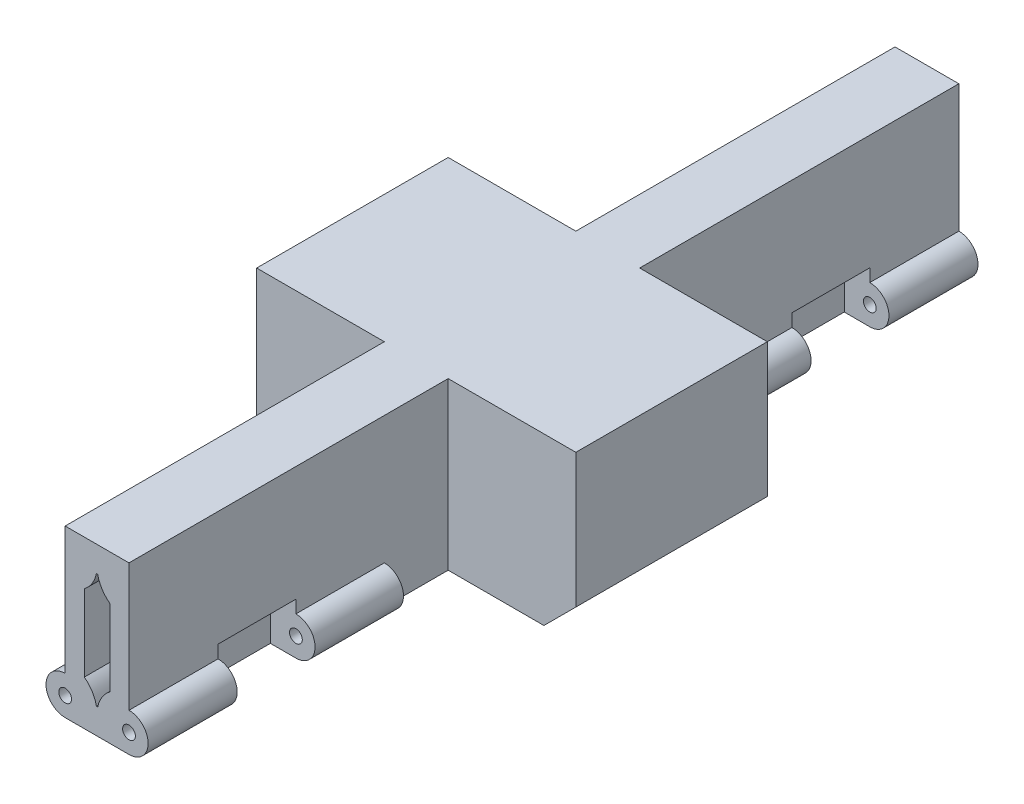
from build123d import *

# Parameters (mm, degrees)
SKETCH_1_W               = 50
SKETCH_1_H               = 26
EXTRUDE_1_DEPTH          = 65
SKETCH_7_W               = 20
SKETCH_7_H               = 26
CUT_EXTRUDE_5_DEPTH      = 50
SKETCH_4_R               = 3
EXTRUDE_3_DEPTH          = 40
SKETCH_5_W               = 12.2
SKETCH_5_H               = 8
CUT_EXTRUDE_3_DEPTH      = 4
SKETCH_6_R               = 1
CUT_EXTRUDE_4_DEPTH      = 40
MIRROR_2_COPY_1_SKETCH_W = 20
MIRROR_2_COPY_1_SKETCH_H = 26
MIRROR_2_COPY_1_DEPTH    = 50
MIRROR_2_COPY_2_SKETCH_R = 3
MIRROR_2_COPY_2_DEPTH    = 40
MIRROR_2_COPY_3_SKETCH_W = 12.2
MIRROR_2_COPY_3_SKETCH_H = 8
MIRROR_2_COPY_3_DEPTH    = 4
MIRROR_2_COPY_4_SKETCH_R = 1
MIRROR_2_COPY_4_DEPTH    = 40
CUT_EXTRUDE_7_DEPTH      = 71.89816586
CUT_EXTRUDE_7_DEPTH_BACK = 71.89816586
CUT_EXTRUDE_8_REACH      = 86.862


with BuildPart() as part:
    # Эскиз1 → Бобышка-Вытянуть1 (new, symmetric)
    with BuildSketch(Plane.XY):
        with Locations((0, -0.287208972)):
            Rectangle(SKETCH_1_W, SKETCH_1_H)
    extrude(amount=EXTRUDE_1_DEPTH, both=True)

    # Эскиз7 → Вырез-Вытянуть5 (cut)
    with BuildSketch(Plane.XY.offset(65)):
        with Locations((-15, -0.287208972)):
            Rectangle(SKETCH_7_W, SKETCH_7_H)
    cut_extrude_5 = extrude(amount=-CUT_EXTRUDE_5_DEPTH, mode=Mode.SUBTRACT)

    # Эскиз4 → Бобышка-Вытянуть3 (add)
    with BuildSketch(Plane.XY.offset(65)):
        with Locations((-5, -10.287208972)):
            Circle(SKETCH_4_R)
    extrude_3 = extrude(amount=-EXTRUDE_3_DEPTH)

    # Эскиз5 → Вырез-Вытянуть3 (cut, symmetric)
    with BuildSketch(Plane.ZY.offset(5)):
        with Locations((44.95, -9.287208972)):
            Rectangle(SKETCH_5_W, SKETCH_5_H)
    cut_extrude_3 = extrude(amount=CUT_EXTRUDE_3_DEPTH, both=True, mode=Mode.SUBTRACT)

    # Эскиз6 → Вырез-Вытянуть4 (cut)
    with BuildSketch(Plane.XY.offset(65)):
        with Locations((-5, -10.287208972)):
            Circle(SKETCH_6_R)
    cut_extrude_4 = extrude(amount=-CUT_EXTRUDE_4_DEPTH, mode=Mode.SUBTRACT)

    # Зеркальное отражение1: Вырез-Вытянуть5, Бобышка-Вытянуть3, Вырез-Вытянуть3, Вырез-Вытянуть4 across plane
    add(cut_extrude_5.mirror(Plane.XY), mode=Mode.SUBTRACT)
    add(extrude_3.mirror(Plane.XY))
    add(cut_extrude_3.mirror(Plane.XY), mode=Mode.SUBTRACT)
    add(cut_extrude_4.mirror(Plane.XY), mode=Mode.SUBTRACT)

    # Зеркальное отражение2: Вырез-Вытянуть5, Бобышка-Вытянуть3, Вырез-Вытянуть3, Вырез-Вытянуть4 across plane
    add(cut_extrude_5.mirror(Plane(origin=(0, 0, 0), x_dir=(0, 0, 1), z_dir=(1, 0, 0))), mode=Mode.SUBTRACT)
    add(extrude_3.mirror(Plane(origin=(0, 0, 0), x_dir=(0, 0, 1), z_dir=(1, 0, 0))))
    add(cut_extrude_3.mirror(Plane(origin=(0, 0, 0), x_dir=(0, 0, 1), z_dir=(1, 0, 0))), mode=Mode.SUBTRACT)
    add(cut_extrude_4.mirror(Plane(origin=(0, 0, 0), x_dir=(0, 0, 1), z_dir=(1, 0, 0))), mode=Mode.SUBTRACT)

    # Зеркальное отражение2 copy 1 sketch → Зеркальное отражение2 copy 1 (cut)
    with BuildSketch(Plane(origin=(0, 0, -65), x_dir=(-1, 0, 0), z_dir=(0, 0, -1))):
        with Locations((-15, -0.287208972)):
            Rectangle(MIRROR_2_COPY_1_SKETCH_W, MIRROR_2_COPY_1_SKETCH_H)
    extrude(amount=-MIRROR_2_COPY_1_DEPTH, mode=Mode.SUBTRACT)

    # Зеркальное отражение2 copy 2 sketch → Зеркальное отражение2 copy 2 (add)
    with BuildSketch(Plane(origin=(0, 0, -65), x_dir=(-1, 0, 0), z_dir=(0, 0, -1))):
        with Locations((-5, -10.287208972)):
            Circle(MIRROR_2_COPY_2_SKETCH_R)
    extrude(amount=-MIRROR_2_COPY_2_DEPTH)

    # Зеркальное отражение2 copy 3 sketch → Зеркальное отражение2 copy 3 (cut, symmetric)
    with BuildSketch(Plane(origin=(5, 0, 0), x_dir=(0, 0, -1), z_dir=(1, 0, 0))):
        with Locations((44.95, -9.287208972)):
            Rectangle(MIRROR_2_COPY_3_SKETCH_W, MIRROR_2_COPY_3_SKETCH_H)
    extrude(amount=MIRROR_2_COPY_3_DEPTH, both=True, mode=Mode.SUBTRACT)

    # Зеркальное отражение2 copy 4 sketch → Зеркальное отражение2 copy 4 (cut)
    with BuildSketch(Plane(origin=(0, 0, -65), x_dir=(-1, 0, 0), z_dir=(0, 0, -1))):
        with Locations((-5, -10.287208972)):
            Circle(MIRROR_2_COPY_4_SKETCH_R)
    extrude(amount=-MIRROR_2_COPY_4_DEPTH, mode=Mode.SUBTRACT)

    # Эскиз9 → Вырез-Вытянуть7 (cut, two sides: drawn at the far end of the back side and taken through both)
    with BuildSketch(Plane.XY.offset(-CUT_EXTRUDE_7_DEPTH_BACK)):
        with BuildLine():
            Line((0, -9.287208972), (0, 8.712791028))
            Line((0, 8.712791028), (-0.101020514, 8.712791028))
            ThreePointArc((-0.101020514, 8.712791028), (-0.775255129, 7.038556414), (-2, 5.712791028))
            Line((-2, 5.712791028), (-2, -6.287208972))
            ThreePointArc((-2, -6.287208972), (-0.775255129, -7.612974358), (-0.101020514, -9.287208972))
            Line((-0.101020514, -9.287208972), (0, -9.287208972))
        make_face()
        with BuildLine():
            Line((0.101020514, 8.712791028), (0, 8.712791028))
            Line((0, 8.712791028), (0, -9.287208972))
            Line((0, -9.287208972), (0.101020514, -9.287208972))
            ThreePointArc((0.101020514, -9.287208972), (0.775255129, -7.612974358), (2, -6.287208972))
            Line((2, -6.287208972), (2, 5.712791028))
            ThreePointArc((2, 5.712791028), (0.775255129, 7.038556414), (0.101020514, 8.712791028))
        make_face()
    extrude(amount=CUT_EXTRUDE_7_DEPTH + CUT_EXTRUDE_7_DEPTH_BACK, mode=Mode.SUBTRACT)

    # Эскиз10 → Вырез-Вытянуть8 (cut, up to next)
    with BuildSketch(Plane.XY.offset(15), mode=Mode.PRIVATE) as cut_extrude_8_sk1:
        Polygon((-20, -13.287208972), (-25, -8.287208972), (-25, -13.287208972), align=None)
    cut_extrude_8_tool1 = extrude(cut_extrude_8_sk1.sketch, amount=-CUT_EXTRUDE_8_REACH, mode=Mode.PRIVATE) & part.part
    # Эскиз10 → Вырез-Вытянуть8 (cut, up to next)
    with BuildSketch(Plane.XY.offset(15), mode=Mode.PRIVATE) as cut_extrude_8_sk2:
        Polygon((20, -13.287208972), (25, -13.287208972), (25, -8.287208972), align=None)
    cut_extrude_8_tool2 = extrude(cut_extrude_8_sk2.sketch, amount=-CUT_EXTRUDE_8_REACH, mode=Mode.PRIVATE) & part.part
    add(cut_extrude_8_tool1.solids().sort_by_distance((-23.333333, -11.620542, 15))[0], mode=Mode.SUBTRACT)
    add(cut_extrude_8_tool2.solids().sort_by_distance((23.333333, -11.620542, 15))[0], mode=Mode.SUBTRACT)


solid = part.part
